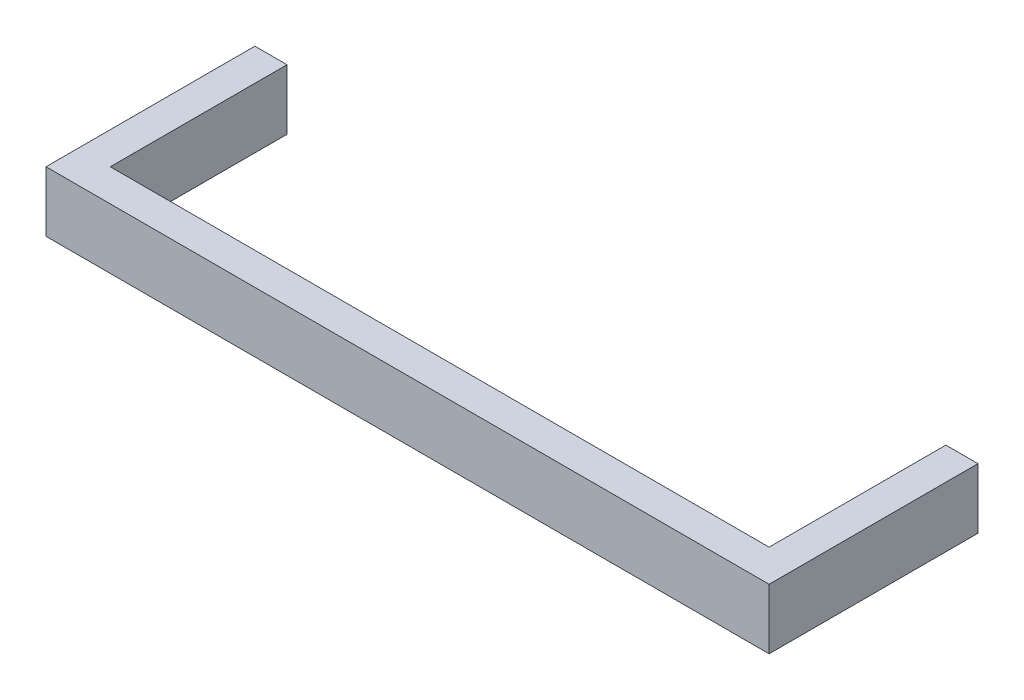
from build123d import *

# Parameters (mm, degrees)
BOSS_EXTRUDE1_DEPTH = 3.75


with BuildPart() as part:
    # Sketch1 → Boss-Extrude1 (new body)
    with BuildSketch(Plane(origin=(0, 0, 0), x_dir=(1, 0, 0), z_dir=(0, 1, 0))):
        Polygon((-16.58865484, 39.01939005), (-16.58865484, 28.01939005), (24.41134516, 28.01939005), (24.41134516, 39.01939005), (26.41134516, 39.01939005), (26.41134516, 26.01939005), (-18.58865484, 26.01939005), (-18.58865484, 39.01939005), align=None)
    extrude(amount=BOSS_EXTRUDE1_DEPTH)


solid = part.part
